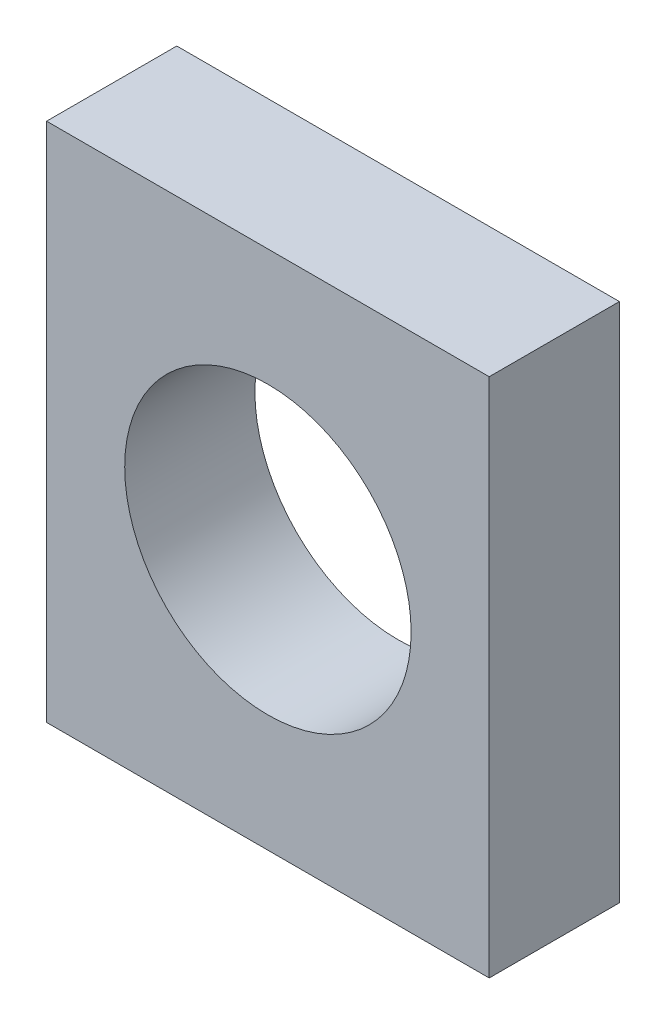
from build123d import *

# Parameters (mm, degrees)
ESQUISSE1_W      = 17
ESQUISSE1_H      = 20
ESQUISSE1_R      = 5.5
EXTRUSION1_DEPTH = 5


with BuildPart() as part:
    # Esquisse1 → Extrusion1 (new body)
    with BuildSketch(Plane.XY):
        Rectangle(ESQUISSE1_W, ESQUISSE1_H)
        Circle(ESQUISSE1_R, mode=Mode.SUBTRACT)
    extrude(amount=EXTRUSION1_DEPTH)


solid = part.part
